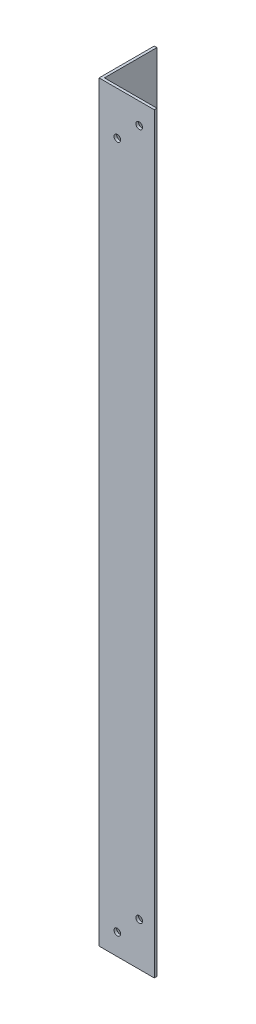
from build123d import *

# Parameters (mm, degrees)
EXTRUDE_1_DEPTH     = 340.5
SKETCH_2_R          = 1.5
CUT_EXTRUDE_1_DEPTH = 343.245073011


with BuildPart() as part:
    # Эскиз1 → Бобышка-Вытянуть1 (new body)
    with BuildSketch(Plane(origin=(0, 0, 0), x_dir=(1, 0, 0), z_dir=(0, 1, 0))):
        Polygon((0, 0), (0, 25), (1.2, 25), (1.2, 1.2), (25, 1.2), (25, 0), align=None)
    extrude(amount=EXTRUDE_1_DEPTH)

    # Эскиз2 → Вырез-Вытянуть1 (cut, through all)
    with BuildSketch(Plane(origin=(0, 0, -1.2), x_dir=(-1, 0, 0), z_dir=(0, 0, -1))):
        with Locations((-18.17, 330.863)):
            Circle(SKETCH_2_R)
        with Locations((-8.270505063, 320.963505063)):
            Circle(SKETCH_2_R)
        with Locations((-18.17, 19.572494937)):
            Circle(SKETCH_2_R)
        with Locations((-8.270505063, 9.673)):
            Circle(SKETCH_2_R)
    extrude(amount=-CUT_EXTRUDE_1_DEPTH, mode=Mode.SUBTRACT)


solid = part.part
